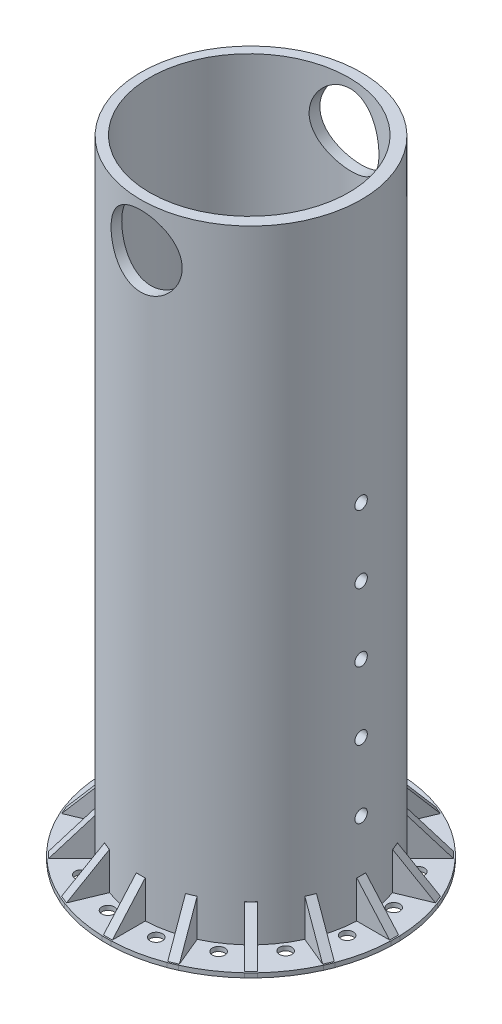
from build123d import *

# Parameters (mm, degrees)
SKETCH1_R               = 162.5
SKETCH1_R_2             = 112
BOSS_EXTRUDE1_DEPTH     = 5
SKETCH2_R               = 124
SKETCH2_R_2             = 112
BOSS_EXTRUDE2_DEPTH     = 42
BOSS_EXTRUDE7_START     = -42
BOSS_EXTRUDE7_DEPTH     = 42
BOSS_EXTRUDE8_START     = -5
BOSS_EXTRUDE8_DEPTH     = 5
BOSS_EXTRUDE12_DEPTH    = 5
CIRPATTERN1_COUNT       = 16
SKETCH13_R              = 7
CUT_EXTRUDE1_DEPTH      = 234.616138141
CIRPATTERN2_COUNT       = 16
SKETCH14_R              = 124
SKETCH14_R_2            = 112
BOSS_EXTRUDE13_DEPTH    = 658
CUT_EXTRUDE2_DEPTH      = 742.510283138
CUT_EXTRUDE2_DEPTH_BACK = 742.510283138
SKETCH15_R              = 40
CUT_EXTRUDE3_DEPTH      = 742.510283233
CUT_EXTRUDE3_DEPTH_BACK = 742.510283233
SKETCH16_R              = 7


with BuildPart() as part:
    # Sketch1 → Boss-Extrude1 (new body)
    with BuildSketch(Plane(origin=(0, 0, 0), x_dir=(1, 0, 0), z_dir=(0, 1, 0))):
        with Locations(Location((0, 0, 0), (0, 0, 270))):
            Circle(SKETCH1_R)
        with Locations(Location((-1.963377112, 0, 0), (0, 0, 270))):
            Circle(SKETCH1_R_2, mode=Mode.SUBTRACT)
    extrude(amount=BOSS_EXTRUDE1_DEPTH)

    # Sketch2 → Boss-Extrude2 (add)
    with BuildSketch(Plane(origin=(0, 5, 0), x_dir=(1, 0, 0), z_dir=(0, 1, 0))):
        with Locations(Location((0, 0, 0), (0, 0, 90))):
            Circle(SKETCH2_R)
        with Locations(Location((-1.963377112, 0, 0), (0, 0, 270))):
            Circle(SKETCH2_R_2, mode=Mode.SUBTRACT)
    extrude(amount=BOSS_EXTRUDE2_DEPTH)

    # Sketch9 → Boss-Extrude7 (add)
    with BuildSketch(Plane(origin=(0, 47, 0), x_dir=(1, 0, 0), z_dir=(0, 1, 0)).offset(BOSS_EXTRUDE7_START)):
        with BuildLine():
            ThreePointArc((-124, 0), (-123.974785571, 2.500508459), (-123.899152539, 5))
            Line((-123.899152539, 5), (-124, 5))
            Line((-124, 5), (-124, 0))
        make_face()
        with BuildLine():
            ThreePointArc((-123.899152539, -5), (-123.974785571, -2.500508459), (-124, 0))
            Line((-124, 0), (-124, -5))
            Line((-124, -5), (-123.899152539, -5))
        make_face()
    boss_extrude7 = extrude(amount=BOSS_EXTRUDE7_DEPTH)

    # Sketch11 → Boss-Extrude8 (add)
    with BuildSketch(Plane(origin=(0, 5, 0), x_dir=(1, 0, 0), z_dir=(0, 1, 0)).offset(BOSS_EXTRUDE8_START)):
        with BuildLine():
            ThreePointArc((-162.5, 0), (-162.480763538, 2.500295981), (-162.423058708, 5))
            Line((-162.423058708, 5), (-162.5, 5))
            Line((-162.5, 5), (-162.5, 0))
        make_face()
        with BuildLine():
            ThreePointArc((-162.423058708, -5), (-162.480763538, -2.500295981), (-162.5, 0))
            Line((-162.5, 0), (-162.5, -5))
            Line((-162.5, -5), (-162.423058708, -5))
        make_face()
    boss_extrude8 = extrude(amount=BOSS_EXTRUDE8_DEPTH)

    # Sketch10 → Boss-Extrude12 (add, symmetric)
    with BuildSketch(Plane.XY):
        Polygon((-124, 47), (-160.924029035, 5), (-124, 5), align=None)
    boss_extrude12 = extrude(amount=BOSS_EXTRUDE12_DEPTH, both=True)

    # CirPattern1: Boss-Extrude7, Boss-Extrude8, Boss-Extrude12 ×16 about axis
    cirpattern1_axis = Axis((0, 0, 0), (0, 1, 0))
    add([boss_extrude7.rotate(cirpattern1_axis, i * 360 / CIRPATTERN1_COUNT) for i in range(1, CIRPATTERN1_COUNT)])
    add([boss_extrude8.rotate(cirpattern1_axis, i * 360 / CIRPATTERN1_COUNT) for i in range(1, CIRPATTERN1_COUNT)])
    add([boss_extrude12.rotate(cirpattern1_axis, i * 360 / CIRPATTERN1_COUNT) for i in range(1, CIRPATTERN1_COUNT)])

    # Sketch13 → Cut-Extrude1 (cut, through all)
    with BuildSketch(Plane(origin=(0, 5, 0), x_dir=(1, 0, 0), z_dir=(0, 1, 0))):
        with Locations(Location((112.925833504, -73.978078695, 0), (0, 0, 270))):
            Circle(SKETCH13_R)
    cut_extrude1 = extrude(amount=-CUT_EXTRUDE1_DEPTH, mode=Mode.SUBTRACT)

    # CirPattern2: Cut-Extrude1 ×16 about axis
    cirpattern2_axis = Axis((-1.963377112, 0, 0), (0, 1, 0))
    for i in range(1, CIRPATTERN2_COUNT):
        add(cut_extrude1.rotate(cirpattern2_axis, i * 360 / CIRPATTERN2_COUNT), mode=Mode.SUBTRACT)

    # Sketch14 → Boss-Extrude13 (add)
    with BuildSketch(Plane(origin=(0, 47, 0), x_dir=(1, 0, 0), z_dir=(0, 1, 0))):
        with Locations(Location((0, 0, 0), (0, 0, 270))):
            Circle(SKETCH14_R)
        with Locations(Location((-1.963377112, 0, 0), (0, 0, 270))):
            Circle(SKETCH14_R_2, mode=Mode.SUBTRACT)
    extrude(amount=BOSS_EXTRUDE13_DEPTH)

    # Sketch15 → Cut-Extrude2 (cut, two sides: drawn at the far end of the back side and taken through both)
    with BuildSketch(Plane.XY.offset(-CUT_EXTRUDE2_DEPTH_BACK)):
        with Locations((0, 655)):
            Circle(SKETCH15_R)
    extrude(amount=CUT_EXTRUDE2_DEPTH + CUT_EXTRUDE2_DEPTH_BACK, mode=Mode.SUBTRACT)

    # Sketch16 → Cut-Extrude3 (cut, two sides: drawn at the far end of the back side and taken through both)
    with BuildSketch(Plane(origin=(0, 0, 0), x_dir=(0, 0, -1), z_dir=(1, 0, 0)).offset(-CUT_EXTRUDE3_DEPTH_BACK)):
        with Locations((0, 105)):
            Circle(SKETCH16_R)
        with Locations((0, 181.25)):
            Circle(SKETCH16_R)
        with Locations((0, 257.5)):
            Circle(SKETCH16_R)
        with Locations((0, 333.75)):
            Circle(SKETCH16_R)
        with Locations((0, 410)):
            Circle(SKETCH16_R)
    extrude(amount=CUT_EXTRUDE3_DEPTH + CUT_EXTRUDE3_DEPTH_BACK, mode=Mode.SUBTRACT)


solid = part.part
